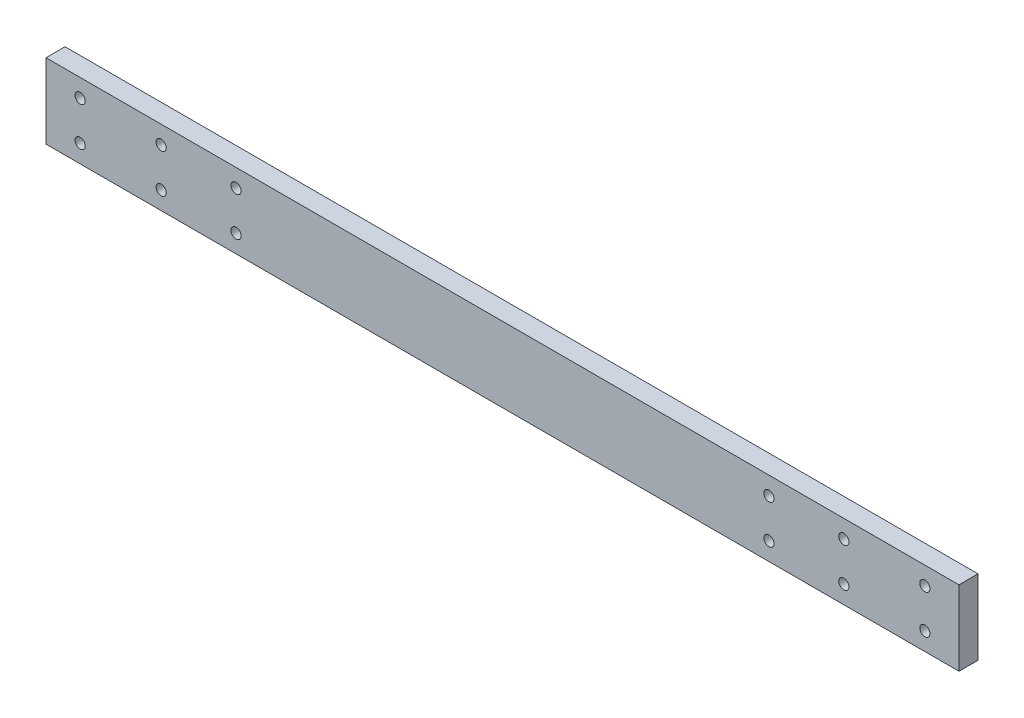
from build123d import *

# Parameters (mm, degrees)
SKETCH1_W           = 304.8
SKETCH1_H           = 25
BOSS_EXTRUDE1_DEPTH = 6.35
SKETCH2_R           = 1.7
CUT_EXTRUDE1_DEPTH  = 30
SKETCH3_R           = 1.7
CUT_EXTRUDE2_DEPTH  = 21


with BuildPart() as part:
    # Sketch1 → Boss-Extrude1 (new body)
    with BuildSketch(Plane.XY):
        with Locations((111.623766163, 223.42362241)):
            Rectangle(SKETCH1_W, SKETCH1_H)
    extrude(amount=BOSS_EXTRUDE1_DEPTH)

    # Sketch2 → Cut-Extrude1 (cut)
    with BuildSketch(Plane.XY.offset(6.35)):
        with Locations((-2.326233838, 229.923622409)):
            Circle(SKETCH2_R)
        with Locations((-2.326233838, 216.923622409)):
            Circle(SKETCH2_R)
        with Locations((-29.376233838, 229.92362241)):
            Circle(SKETCH2_R)
        with Locations((-29.376233838, 216.92362241)):
            Circle(SKETCH2_R)
        with Locations((252.623766162, 229.923622411)):
            Circle(SKETCH2_R)
        with Locations((252.623766162, 216.923622411)):
            Circle(SKETCH2_R)
        with Locations((225.573766162, 229.92362241)):
            Circle(SKETCH2_R)
        with Locations((225.573766162, 216.92362241)):
            Circle(SKETCH2_R)
    extrude(amount=-CUT_EXTRUDE1_DEPTH, mode=Mode.SUBTRACT)

    # Sketch3 → Cut-Extrude2 (cut)
    with BuildSketch(Plane.XY.offset(6.35)):
        with Locations((22.673766162, 216.923622409)):
            Circle(SKETCH3_R)
        with Locations((22.673766162, 229.923622409)):
            Circle(SKETCH3_R)
        with Locations((200.573766162, 216.92362241)):
            Circle(SKETCH3_R)
        with Locations((200.573766162, 229.92362241)):
            Circle(SKETCH3_R)
    extrude(amount=-CUT_EXTRUDE2_DEPTH, mode=Mode.SUBTRACT)


solid = part.part
